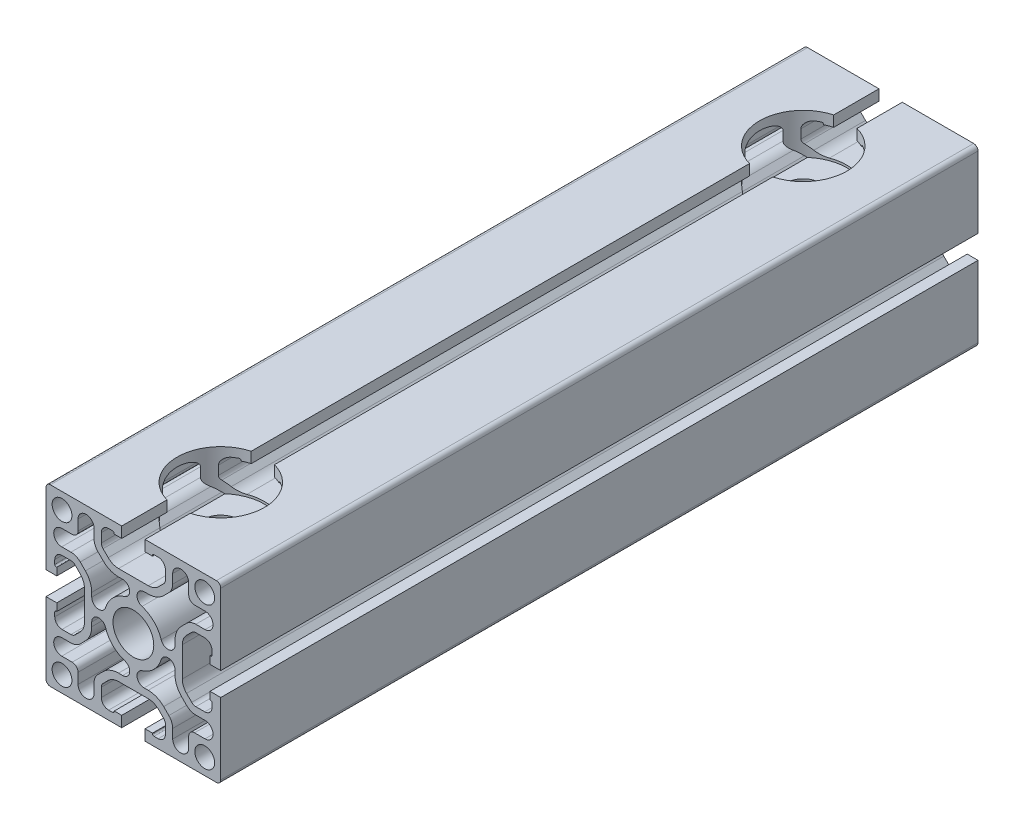
from build123d import *

# Parameters (mm, degrees)
SKETCH1_R               = 3.4
SKETCH1_R_2             = 7
BOSS_EXTRUDE1_DEPTH     = 260
CUT_EXTRUDE1_DEPTH      = 264.438797446
CUT_EXTRUDE1_DEPTH_BACK = 264.438797446
SKETCH2_R               = 6
CUT_EXTRUDE2_START      = 30
SKETCH3_R               = 15
CUT_EXTRUDE2_DEPTH      = 14


with BuildPart() as part:
    # Sketch1 → Boss-Extrude1 (new body)
    with BuildSketch(Plane(origin=(0, 0, 0), x_dir=(-1, 0, 0), z_dir=(0, 0, -1))):
        with BuildLine():
            Line((5.1, 16.8), (-5.11, 16.8))
            ThreePointArc((-5.11, 16.8), (-7.023417162, 17.180602337), (-8.645533906, 18.264466094))
            Line((-8.645533906, 18.264466094), (-10.42, 20.04))
            ThreePointArc((-10.42, 20.04), (-10.849063493, 20.687796578), (-11, 21.45))
            Line((-11, 21.45), (-11, 24.5))
            ThreePointArc((-11, 24.5), (-10.267766953, 26.267766953), (-8.5, 27))
            Line((-8.5, 27), (-7.07, 27))
            ThreePointArc((-7.07, 27), (-6.716446609, 26.853553391), (-6.57, 26.5))
            Line((-6.57, 26.5), (-6.57, 26.3))
            Line((-6.57, 26.3), (-4, 26.3))
            Line((-4, 26.3), (-4, 30))
            Line((-4, 30), (-28.5, 30))
            ThreePointArc((-28.5, 30), (-29.560660172, 29.560660172), (-30, 28.5))
            Line((-30, 28.5), (-30, 4))
            Line((-30, 4), (-26.3, 4))
            Line((-26.3, 4), (-26.3, 6.57))
            Line((-26.3, 6.57), (-26.500000003, 6.57))
            ThreePointArc((-26.500000003, 6.57), (-26.853553391, 6.716446609), (-27, 7.069999997))
            Line((-27, 7.069999997), (-27, 8.500000474))
            ThreePointArc((-27, 8.500000474), (-26.267767092, 10.267767092), (-24.500000474, 11))
            Line((-24.500000474, 11), (-21.45, 11))
            ThreePointArc((-21.45, 11), (-20.684633135, 10.847759065), (-20.035786438, 10.414213562))
            Line((-20.035786438, 10.414213562), (-18.27, 8.65))
            ThreePointArc((-18.27, 8.65), (-17.181928688, 7.026614358), (-16.8, 5.11))
            Line((-16.8, 5.11), (-16.8, -5.1))
            ThreePointArc((-16.8, -5.1), (-17.180602337, -7.013417162), (-18.264466094, -8.635533906))
            Line((-18.264466094, -8.635533906), (-20.04, -10.41))
            ThreePointArc((-20.04, -10.41), (-20.685169913, -10.847983768), (-21.45, -11))
            Line((-21.45, -11), (-24.5, -11))
            ThreePointArc((-24.5, -11), (-26.267766953, -10.267766953), (-27, -8.5))
            Line((-27, -8.5), (-27, -7.07))
            ThreePointArc((-27, -7.07), (-26.853553391, -6.716446609), (-26.5, -6.57))
            Line((-26.5, -6.57), (-26.3, -6.57))
            Line((-26.3, -6.57), (-26.3, -4))
            Line((-26.3, -4), (-30, -4))
            Line((-30, -4), (-30, -28.5))
            ThreePointArc((-30, -28.5), (-29.560660172, -29.560660172), (-28.5, -30))
            Line((-28.5, -30), (-4, -30))
            Line((-4, -30), (-4, -26.3))
            Line((-4, -26.3), (-6.57, -26.3))
            Line((-6.57, -26.3), (-6.57, -26.5))
            ThreePointArc((-6.57, -26.5), (-6.716446609, -26.853553391), (-7.07, -27))
            Line((-7.07, -27), (-8.5, -27))
            ThreePointArc((-8.5, -27), (-10.267766953, -26.267766953), (-11, -24.5))
            Line((-11, -24.5), (-11, -21.45))
            ThreePointArc((-11, -21.45), (-10.847759065, -20.684633135), (-10.414213562, -20.035786438))
            Line((-10.414213562, -20.035786438), (-8.65, -18.26))
            ThreePointArc((-8.65, -18.26), (-7.024002341, -17.180843639), (-5.11, -16.8))
            Line((-5.11, -16.8), (5.1, -16.8))
            ThreePointArc((5.1, -16.8), (7.014002341, -17.180843639), (8.64, -18.26))
            Line((8.64, -18.26), (10.41, -20.03))
            ThreePointArc((10.41, -20.03), (10.846363066, -20.681264642), (11, -21.45))
            Line((11, -21.45), (11, -24.5))
            ThreePointArc((11, -24.5), (10.267766953, -26.267766953), (8.5, -27))
            Line((8.5, -27), (7.07, -27))
            ThreePointArc((7.07, -27), (6.716446609, -26.853553391), (6.57, -26.5))
            Line((6.57, -26.5), (6.57, -26.3))
            Line((6.57, -26.3), (4, -26.3))
            Line((4, -26.3), (4, -30))
            Line((4, -30), (28.5, -30))
            ThreePointArc((28.5, -30), (29.560660172, -29.560660172), (30, -28.5))
            Line((30, -28.5), (30, -4))
            Line((30, -4), (26.3, -4))
            Line((26.3, -4), (26.3, -6.57))
            Line((26.3, -6.57), (26.5, -6.57))
            ThreePointArc((26.5, -6.57), (26.853553391, -6.716446609), (27, -7.07))
            Line((27, -7.07), (27, -8.5))
            ThreePointArc((27, -8.5), (26.267766953, -10.267766953), (24.5, -11))
            Line((24.5, -11), (21.45, -11))
            ThreePointArc((21.45, -11), (20.684633135, -10.847759065), (20.035786438, -10.414213562))
            Line((20.035786438, -10.414213562), (18.26, -8.64))
            ThreePointArc((18.26, -8.64), (17.180843639, -7.014002341), (16.8, -5.1))
            Line((16.8, -5.1), (16.8, 5.11))
            ThreePointArc((16.8, 5.11), (17.180843639, 7.024002341), (18.26, 8.65))
            Line((18.26, 8.65), (20.035786438, 10.414213562))
            ThreePointArc((20.035786438, 10.414213562), (20.684633135, 10.847759065), (21.45, 11))
            Line((21.45, 11), (24.5, 11))
            ThreePointArc((24.5, 11), (26.267766953, 10.267766953), (27, 8.5))
            Line((27, 8.5), (27, 7.07))
            ThreePointArc((27, 7.07), (26.853553391, 6.716446609), (26.5, 6.57))
            Line((26.5, 6.57), (26.3, 6.57))
            Line((26.3, 6.57), (26.3, 4))
            Line((26.3, 4), (30, 4))
            Line((30, 4), (30, 28.5))
            ThreePointArc((30, 28.5), (29.560660172, 29.560660172), (28.5, 30))
            Line((28.5, 30), (4, 30))
            Line((4, 30), (4, 26.3))
            Line((4, 26.3), (6.57, 26.3))
            Line((6.57, 26.3), (6.57, 26.5))
            ThreePointArc((6.57, 26.5), (6.71641961, 26.85358039), (7.07, 27))
            Line((7.07, 27), (8.5, 27))
            ThreePointArc((8.5, 27), (10.267766953, 26.267766953), (11, 24.5))
            Line((11, 24.5), (11, 21.45))
            ThreePointArc((11, 21.45), (10.847759065, 20.684633135), (10.414213562, 20.035786438))
            Line((10.414213562, 20.035786438), (8.64, 18.27))
            ThreePointArc((8.64, 18.27), (7.016614358, 17.181928688), (5.1, 16.8))
        make_face()
        with Locations(Location((-24.5, 24.5, 0), (0, 0, 180))):
            Circle(SKETCH1_R, mode=Mode.SUBTRACT)
        with Locations(Location((24.5, 24.5, 0), (0, 0, 180))):
            Circle(SKETCH1_R, mode=Mode.SUBTRACT)
        with Locations(Location((-24.5, -24.49, 0), (0, 0, 180))):
            Circle(SKETCH1_R, mode=Mode.SUBTRACT)
        with Locations(Location((24.5, -24.49, 0), (0, 0, 180))):
            Circle(SKETCH1_R, mode=Mode.SUBTRACT)
        with Locations(Location((0, 0, 0), (0, 0, 180))):
            Circle(SKETCH1_R_2, mode=Mode.SUBTRACT)
        with BuildLine():
            Line((5.103398282, -14.3), (3.678409373, -14.3))
            ThreePointArc((3.678409373, -14.3), (1.27735351, -12.23505015), (2.959678316, -9.551979076))
            ThreePointArc((2.959678316, -9.551979076), (7.071067812, -7.071067812), (9.551979076, -2.959678316))
            ThreePointArc((9.551979076, -2.959678316), (12.23505015, -1.27735351), (14.3, -3.678409373))
            Line((14.3, -3.678409373), (14.3, -5.11339393))
            ThreePointArc((14.3, -5.11339393), (14.86686796, -7.973757565), (16.481781365, -10.401734932))
            Line((16.481781365, -10.401734932), (18.243100081, -12.173004601))
            ThreePointArc((18.243100081, -12.173004601), (19.706101967, -13.155028322), (21.434031262, -13.5))
            Line((21.434031262, -13.5), (24.6, -13.5))
            ThreePointArc((24.6, -13.5), (27.35, -16.25), (24.6, -19))
            Line((24.6, -19), (21, -19))
            ThreePointArc((21, -19), (19.585786438, -19.585786438), (19, -21))
            Line((19, -21), (19, -24.6))
            ThreePointArc((19, -24.6), (16.25, -27.35), (13.5, -24.6))
            Line((13.5, -24.6), (13.5, -21.453961031))
            ThreePointArc((13.5, -21.453961031), (13.157457896, -19.731885585), (12.181980515, -18.271980515))
            Line((12.181980515, -18.271980515), (10.406699141, -16.496699141))
            ThreePointArc((10.406699141, -16.496699141), (7.973524025, -14.870903506), (5.103398282, -14.3))
        make_face(mode=Mode.SUBTRACT)
        with BuildLine():
            Line((-3.678409373, -14.3), (-5.103398282, -14.3))
            ThreePointArc((-5.103398282, -14.3), (-7.973524025, -14.870903506), (-10.406699141, -16.496699141))
            Line((-10.406699141, -16.496699141), (-12.181980515, -18.271980515))
            ThreePointArc((-12.181980515, -18.271980515), (-13.157457896, -19.731885585), (-13.5, -21.453961031))
            Line((-13.5, -21.453961031), (-13.5, -24.6))
            ThreePointArc((-13.5, -24.6), (-16.25, -27.35), (-19, -24.6))
            Line((-19, -24.6), (-19, -21))
            ThreePointArc((-19, -21), (-19.585786438, -19.585786438), (-21, -19))
            Line((-21, -19), (-24.6, -19))
            ThreePointArc((-24.6, -19), (-27.35, -16.25), (-24.6, -13.5))
            Line((-24.6, -13.5), (-21.434031262, -13.5))
            ThreePointArc((-21.434031262, -13.5), (-19.706101967, -13.155028322), (-18.243100081, -12.173004601))
            Line((-18.243100081, -12.173004601), (-16.481781365, -10.401734932))
            ThreePointArc((-16.481781365, -10.401734932), (-14.86686796, -7.973757565), (-14.3, -5.11339393))
            Line((-14.3, -5.11339393), (-14.3, -3.678409373))
            ThreePointArc((-14.3, -3.678409373), (-12.23505015, -1.27735351), (-9.551979076, -2.959678316))
            ThreePointArc((-9.551979076, -2.959678316), (-7.071067812, -7.071067812), (-2.959678316, -9.551979076))
            ThreePointArc((-2.959678316, -9.551979076), (-1.27735351, -12.23505015), (-3.678409373, -14.3))
        make_face(mode=Mode.SUBTRACT)
        with BuildLine():
            Line((-5.103398282, 14.3), (-3.678409373, 14.3))
            ThreePointArc((-3.678409373, 14.3), (-1.27735351, 12.23505015), (-2.959678316, 9.551979076))
            ThreePointArc((-2.959678316, 9.551979076), (-7.071067812, 7.071067812), (-9.551979076, 2.959678316))
            ThreePointArc((-9.551979076, 2.959678316), (-12.23505015, 1.27735351), (-14.3, 3.678409373))
            Line((-14.3, 3.678409373), (-14.3, 5.11339393))
            ThreePointArc((-14.3, 5.11339393), (-14.86686796, 7.973757565), (-16.481781365, 10.401734932))
            Line((-16.481781365, 10.401734932), (-18.243100081, 12.173004601))
            ThreePointArc((-18.243100081, 12.173004601), (-19.706101967, 13.155028322), (-21.434031262, 13.5))
            Line((-21.434031262, 13.5), (-24.6, 13.5))
            ThreePointArc((-24.6, 13.5), (-27.35, 16.25), (-24.6, 19))
            Line((-24.6, 19), (-21, 19))
            ThreePointArc((-21, 19), (-19.585786438, 19.585786438), (-19, 21))
            Line((-19, 21), (-19, 24.6))
            ThreePointArc((-19, 24.6), (-16.25, 27.35), (-13.5, 24.6))
            Line((-13.5, 24.6), (-13.5, 21.453961031))
            ThreePointArc((-13.5, 21.453961031), (-13.157457896, 19.731885585), (-12.181980515, 18.271980515))
            Line((-12.181980515, 18.271980515), (-10.406699141, 16.496699141))
            ThreePointArc((-10.406699141, 16.496699141), (-7.973524025, 14.870903506), (-5.103398282, 14.3))
        make_face(mode=Mode.SUBTRACT)
        with BuildLine():
            Line((3.678409373, 14.3), (5.103398282, 14.3))
            ThreePointArc((5.103398282, 14.3), (7.973524025, 14.870903506), (10.406699141, 16.496699141))
            Line((10.406699141, 16.496699141), (12.181980515, 18.271980515))
            ThreePointArc((12.181980515, 18.271980515), (13.157457896, 19.731885585), (13.5, 21.453961031))
            Line((13.5, 21.453961031), (13.5, 24.6))
            ThreePointArc((13.5, 24.6), (16.25, 27.35), (19, 24.6))
            Line((19, 24.6), (19, 21))
            ThreePointArc((19, 21), (19.585786438, 19.585786438), (21, 19))
            Line((21, 19), (24.6, 19))
            ThreePointArc((24.6, 19), (27.35, 16.25), (24.6, 13.5))
            Line((24.6, 13.5), (21.434031262, 13.5))
            ThreePointArc((21.434031262, 13.5), (19.706101967, 13.155028322), (18.243100081, 12.173004601))
            Line((18.243100081, 12.173004601), (16.481781365, 10.401734932))
            ThreePointArc((16.481781365, 10.401734932), (14.86686796, 7.973757565), (14.3, 5.11339393))
            Line((14.3, 5.11339393), (14.3, 3.678409373))
            ThreePointArc((14.3, 3.678409373), (12.23505015, 1.27735351), (9.551979076, 2.959678316))
            ThreePointArc((9.551979076, 2.959678316), (7.071067812, 7.071067812), (2.959678316, 9.551979076))
            ThreePointArc((2.959678316, 9.551979076), (1.27735351, 12.23505015), (3.678409373, 14.3))
        make_face(mode=Mode.SUBTRACT)
    extrude(amount=-BOSS_EXTRUDE1_DEPTH)

    # Sketch2 → Cut-Extrude1 (cut, two sides: drawn at the far end of the back side and taken through both)
    with BuildSketch(Plane(origin=(0, 0, 0), x_dir=(1, 0, 0), z_dir=(0, 1, 0)).offset(-CUT_EXTRUDE1_DEPTH_BACK)):
        with Locations(Location((0.005, -230, 0), (0, 0, 270))):
            Circle(SKETCH2_R)
        with Locations(Location((0, -30, 0), (0, 0, 270))):
            Circle(SKETCH2_R)
    extrude(amount=CUT_EXTRUDE1_DEPTH + CUT_EXTRUDE1_DEPTH_BACK, mode=Mode.SUBTRACT)

    # Sketch3 → Cut-Extrude2 (cut)
    with BuildSketch(Plane(origin=(0, 0, 0), x_dir=(1, 0, 0), z_dir=(0, 1, 0)).offset(CUT_EXTRUDE2_START)):
        with Locations(Location((0.005, -230, 0), (0, 0, 285.446194741))):
            Circle(SKETCH3_R)
        with Locations(Location((0, -30, 0), (0, 0, 285.466009953))):
            Circle(SKETCH3_R)
    extrude(amount=-CUT_EXTRUDE2_DEPTH, mode=Mode.SUBTRACT)


solid = part.part
